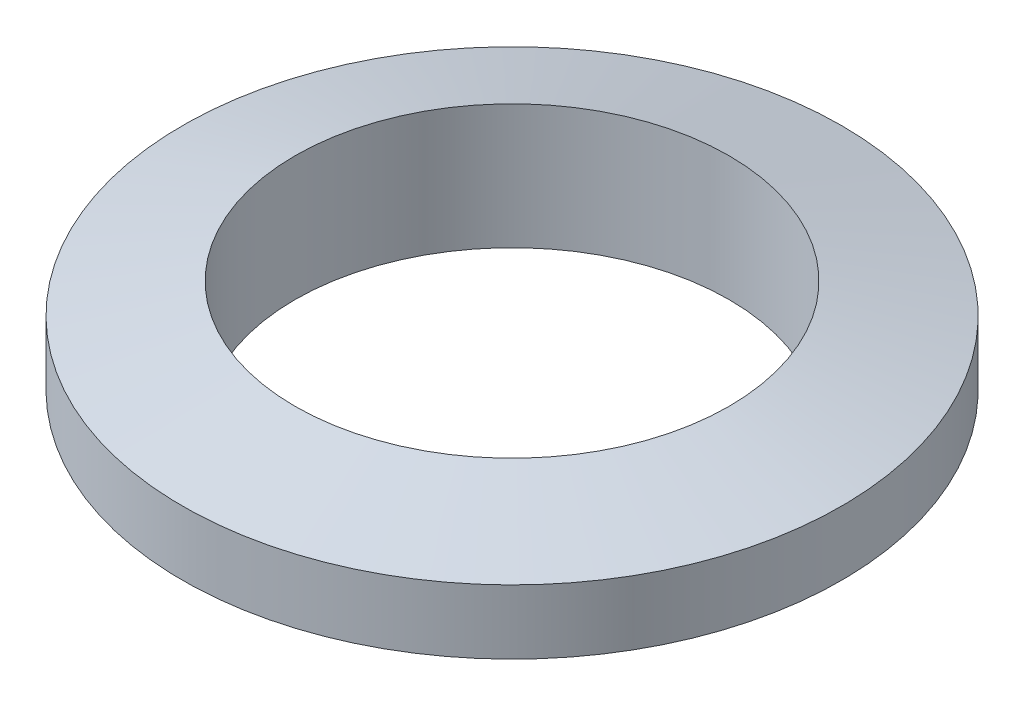
from build123d import *


with BuildPart() as part:
    # 草图1 → 旋转1 (revolve)
    with BuildSketch(Plane.XY, mode=Mode.PRIVATE) as revolve_1_sk:
        Polygon((-20.5, -2), (-20.5, 2), (-13.5, 3.875644347), (-13.5, -3.875644347), align=None)
    revolve(revolve_1_sk.sketch.rotate(Axis((0, 0, 0), (0, 1, 0)), 270), axis=Axis((0, 0, 0), (0, 1, 0)))


solid = part.part
